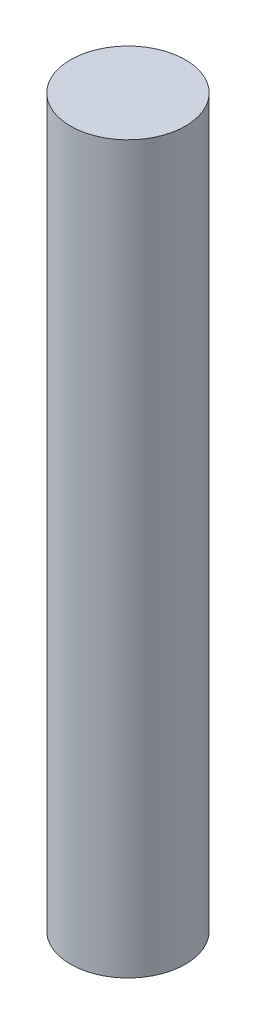
from build123d import *

# Parameters (mm, degrees)
SKETCH1_R           = 4.75
BOSS_EXTRUDE1_DEPTH = 60


with BuildPart() as part:
    # Sketch1 → Boss-Extrude1 (new body)
    with BuildSketch(Plane(origin=(0, 0, 0), x_dir=(1, 0, 0), z_dir=(0, 1, 0))):
        with Locations(Location((0, 0, 0), (0, 0, 270))):
            Circle(SKETCH1_R)
    extrude(amount=BOSS_EXTRUDE1_DEPTH)


solid = part.part
